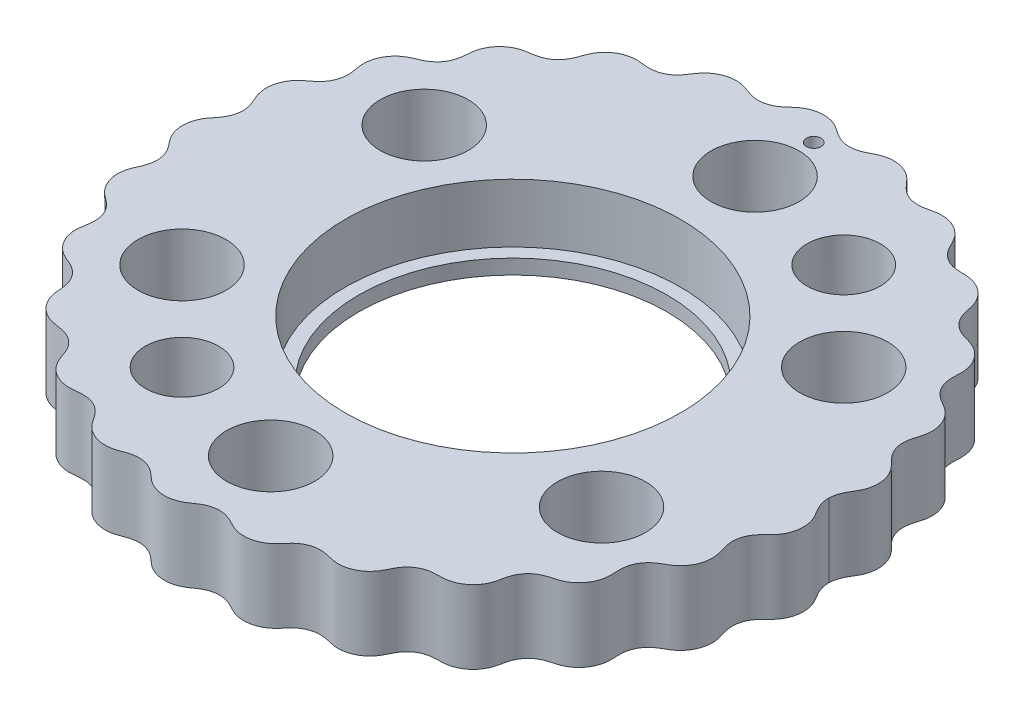
from build123d import *

# Parameters (mm, degrees)
BOSS_EXTRUDE1_DEPTH = 5
SKETCH2_R           = 11.425
CUT_EXTRUDE1_DEPTH  = 5
SKETCH3_R           = 3
CUT_EXTRUDE2_DEPTH  = 5
CIRPATTERN1_COUNT   = 6
SKETCH5_R           = 2.5
CUT_EXTRUDE3_DEPTH  = 5
CIRPATTERN2_COUNT   = 2
SKETCH6_R           = 0.5
CUT_EXTRUDE4_DEPTH  = 5
SKETCH7_R           = 12.374584978
SKETCH7_R_2         = 10.5
BOSS_EXTRUDE2_DEPTH = 1


with BuildPart() as part:
    # Sketch1 → Boss-Extrude1 (new body)
    with BuildSketch(Plane(origin=(0, 0, 0), x_dir=(1, 0, 0), z_dir=(0, 1, 0))):
        with BuildLine():
            add(Edge.make_bspline(
                [(21.5, 0), (21.5, -0.022795648), (21.501029798, -0.067704723), (21.505664016, -0.163287209), (21.517971578, -0.26706608), (21.536306326, -0.371602284), (21.560512677, -0.476256498), (21.597844303, -0.604628879), (21.648832285, -0.742870008), (21.715471931, -0.88939095), (21.798303927, -1.042889143), (21.880905824, -1.181287951), (21.965634084, -1.318335744), (22.047743353, -1.457058781), (22.141568148, -1.635443324), (22.286254031, -1.981582502), (22.368421524, -2.421033858), (22.335811077, -2.934910183), (22.174145209, -3.419701894), (21.99095847, -3.749480386), (21.771971642, -4.023287517), (21.538963332, -4.247536075), (21.287578906, -4.490419955), (21.052310467, -4.786004888), (20.86628673, -5.14590219), (20.761450474, -5.564770662), (20.755735036, -5.968942065), (20.822508646, -6.33892296), (20.926642695, -6.670776317), (21.020849566, -6.978393405), (21.078180272, -7.322549411), (21.07746081, -7.697824683), (21.003081253, -8.093784755), (20.843555833, -8.492539022), (20.623320583, -8.831594486), (20.362510139, -9.105298429), (20.080844855, -9.315588837), (19.798436738, -9.474596917), (19.494129238, -9.64843046), (19.193042299, -9.878112973), (18.922392637, -10.184987884), (18.716598269, -10.57271997), (18.614737076, -10.967683861), (18.592455277, -11.342616983), (18.611533827, -11.683028301), (18.624118313, -11.991107125), (18.595106734, -12.331071898), (18.502842362, -12.693216528), (18.332373701, -13.060611077), (18.07506318, -13.411620433), (17.774315371, -13.686679911), (17.45226868, -13.886415414), (17.125969418, -14.019230522), (16.812052534, -14.10255859), (16.473441864, -14.19622458), (16.124477284, -14.345719993), (15.780825809, -14.581977707), (15.478806711, -14.920833453), (15.28347244, -15.293586784), (15.174931043, -15.663684232), (15.111271631, -15.999784886), (15.043162779, -16.292876076), (14.927308659, -16.603267876), (14.748557662, -16.917576626), (14.495569598, -17.220812425), (14.163796574, -17.490305612), (13.806621751, -17.679399775), (13.443827203, -17.791931371), (13.093811397, -17.838332699), (12.768326214, -17.84035428), (12.416218343, -17.847687856), (12.040347656, -17.907509571), (11.649083059, -18.053250928), (11.273805116, -18.308626347), (10.993969347, -18.622244194), (10.798612314, -18.953719647), (10.654007457, -19.262720966), (10.514614641, -19.528768994), (10.324875693, -19.799088995), (10.073180539, -20.057986893), (9.752841289, -20.287160796), (9.363541622, -20.46556076), (8.890919825, -20.57649638), (8.423854169, -20.577347209), (8.001081062, -20.472684128), (7.57883967, -20.372597395), (7.198227195, -20.339565738), (6.783114608, -20.385259833), (6.356838556, -20.542207313), (6.00963401, -20.777770328), (5.73968902, -21.050783987), (5.523491298, -21.313556792), (5.322168119, -21.535472055), (5.07092742, -21.748791531), (4.763134857, -21.935439316), (4.29408165, -22.115901487), (3.783055418, -22.1727341), (3.297088475, -22.104238721), (2.866674117, -21.933132883), (2.579725015, -21.77656141), (2.265356433, -21.613984902), (1.904213196, -21.487930325), (1.489492014, -21.43166374), (1.038183469, -21.480080885), (0.644348302, -21.624091729), (0.316735371, -21.822019344), (0.042681085, -22.022602977), (-0.207399968, -22.186150065), (-0.597604776, -22.374600245), (-1.057287769, -22.479745044), (-1.563801935, -22.471181397), (-2.0548083, -22.332884975), (-2.397195938, -22.162174798), (-2.683863792, -21.952135463), (-2.922921233, -21.728064998), (-3.188279446, -21.492612679), (-3.508432994, -21.281556117), (-3.897493454, -21.125958051), (-4.347012431, -21.063310642), (-4.763563312, -21.107046937), (-5.128740485, -21.218475955), (-5.443245943, -21.34434571), (-5.725817036, -21.439628514), (-6.047650464, -21.503033396), (-6.405616351, -21.516023092), (-6.902823494, -21.445697437), (-7.377363339, -21.246774053), (-7.769557412, -20.949554121), (-8.063173053, -20.588651874), (-8.239077219, -20.311455053), (-8.438723108, -20.017116066), (-8.698282208, -19.733587722), (-9.038192038, -19.487722925), (-9.45901837, -19.317802372), (-9.873174211, -19.258864262), (-10.253551651, -19.277412057), (-10.588658346, -19.321104209), (-10.885442225, -19.342148983), (-11.212077228, -19.322458845), (-11.560942235, -19.24512832), (-12.024362415, -19.052244368), (-12.433895401, -18.74040472), (-12.739135206, -18.353567785), (-12.932764824, -17.929380009), (-13.03396784, -17.61633628), (-13.155335503, -17.281109595), (-13.338197746, -16.941939529), (-13.60842197, -16.620421988), (-13.975336461, -16.353398259), (-14.362209434, -16.195580127), (-14.73457759, -16.120567373), (-15.069235266, -16.079702705), (-15.361090299, -16.025484945), (-15.671490101, -15.924358306), (-15.988873392, -15.762127945), (-16.38887568, -15.459109626), (-16.707032953, -15.054306911), (-16.905517751, -14.602434605), (-16.986060099, -14.142225311), (-17.00606609, -13.812939099), (-17.051601747, -13.348551502), (-17.205253358, -12.865282323), (-17.522142778, -12.422071438), (-17.947236195, -12.110008614), (-18.289238992, -11.946244216), (-18.602329975, -11.823879909), (-18.870601873, -11.69813388), (-19.144821884, -11.522520555), (-19.410516215, -11.286178284), (-19.716878667, -10.89842961), (-19.923557011, -10.431222541), (-20.0056077, -9.944334415), (-19.970308009, -9.47363097), (-19.903591545, -9.135070859), (-19.83440386, -8.668455805), (-19.870044656, -8.161827089), (-20.070594664, -7.659669711), (-20.402230458, -7.259132681), (-20.692867795, -7.017192803), (-20.965060867, -6.821236211), (-21.192500704, -6.632420304), (-21.413104702, -6.393941278), (-21.610286017, -6.099056667), (-21.809358495, -5.646969614), (-21.892108847, -5.142649073), (-21.8490157, -4.650092571), (-21.695886456, -4.202493127), (-21.546389968, -3.890661396), (-21.364214881, -3.454313727), (-21.2752362, -2.953572409), (-21.347779944, -2.417613532), (-21.571739533, -1.94863668), (-21.793616501, -1.643608799), (-22.007962526, -1.38669879), (-22.180138863, -1.147218268), (-22.333166654, -0.861550026), (-22.449530911, -0.527309468), (-22.529817024, -0.03256193), (-22.480655767, 0.480654905), (-22.311295657, 0.946245125), (-22.002770959, 1.406141242), (-21.706912708, 1.735221765), (-21.458927528, 2.140901932), (-21.317293845, 2.626299801), (-21.299292376, 3.079506214), (-21.381563669, 3.48702089), (-21.521510343, 3.835956348), (-21.664791087, 4.137603074), (-21.770864519, 4.41201509), (-21.846804342, 4.726329942), (-21.875244476, 5.078219246), (-21.828721188, 5.577142974), (-21.652165295, 6.061707092), (-21.370775746, 6.470366782), (-20.955394907, 6.838363024), (-20.586320994, 7.084299028), (-20.245940934, 7.418047432), (-19.990156362, 7.854878416), (-19.862619111, 8.290106394), (-19.843143505, 8.704841324), (-19.893083468, 9.076451436), (-19.956586036, 9.403584096), (-19.989983786, 9.695061487), (-19.98440046, 10.017868008), (-19.92336198, 10.364355079), (-19.777759505, 10.76859641), (-19.507474752, 11.197000284), (-19.143216247, 11.547990856), (-18.706972183, 11.788081108), (-18.292122029, 11.941450822), (-17.941129322, 12.11582572), (-17.615038978, 12.359203902), (-17.34070718, 12.67707834), (-17.113066507, 13.113027475), (-16.996377802, 13.660569401), (-17.005440062, 14.33064165), (-16.736351844, 15.061621091), (-16.291275669, 15.574383195), (-15.7979407, 15.878565793), (-15.396019325, 16.015951733), (-15.107915534, 16.074466171), (-14.777158659, 16.114872858), (-14.407998329, 16.182770941), (-14.019697585, 16.329957912), (-13.645572173, 16.586426943), (-13.309830789, 16.965010476), (-13.098331613, 17.39191391), (-12.978574811, 17.818587814), (-12.756675288, 18.326990835), (-12.391345751, 18.802667249), (-11.899751276, 19.139902225), (-11.346793463, 19.309760982), (-10.921462874, 19.341850779), (-10.627753819, 19.325657195), (-10.352771787, 19.289869825), (-10.092339832, 19.268899376), (-9.790034832, 19.272905369), (-9.453775673, 19.325894331), (-9.082581512, 19.463746877), (-8.665300534, 19.748942197), (-8.356770982, 20.110327011), (-8.135426756, 20.493177528), (-7.793138218, 20.928144818), (-7.402598313, 21.232663484), (-6.929586979, 21.437663869), (-6.434154237, 21.513854894), (-6.080084769, 21.506172865), (-5.760958736, 21.448581022), (-5.479899184, 21.358530085), (-5.169132807, 21.233963947), (-4.810101908, 21.117475578), (-4.294692157, 21.050129493), (-3.762734746, 21.147605566), (-3.314509588, 21.387517302), (-2.956302797, 21.695711591), (-2.70600699, 21.934036961), (-2.327591546, 22.217460753), (-1.872484404, 22.410222198), (-1.367263375, 22.487008273), (-0.875779743, 22.437035066), (-0.534230894, 22.340275407), (-0.239225417, 22.203808062), (0.010720095, 22.045517624), (0.281222998, 21.847088875), (0.601784201, 21.645581136), (1.085181931, 21.454681383), (1.713456872, 21.414221877), (2.285360203, 21.597169023), (2.760125969, 21.888661976), (3.277579761, 22.099810423), (3.765454926, 22.171888366), (4.273850966, 22.119309227), (4.737062589, 21.947446426), (5.04408436, 21.76739805), (5.295754923, 21.560509399), (5.498217892, 21.343909703), (5.711462572, 21.083791212), (5.973369428, 20.809204665), (6.402018612, 20.501933684), (6.92169077, 20.338358431), (7.428580823, 20.342284694), (7.883936963, 20.442761402), (8.203134168, 20.525328514), (8.665489831, 20.590471533), (9.156357978, 20.540961927), (9.639490391, 20.363153423), (10.051125909, 20.076048833), (10.303448351, 19.823952951), (10.495425551, 19.559644236), (10.637039356, 19.298544842), (10.779422473, 18.992700986), (10.966305296, 18.661698904), (11.236504618, 18.342817726), (11.604285591, 18.076967478), (11.993693004, 17.919974798), (12.372607378, 17.851383689), (12.728707497, 17.839818708), (13.057515712, 17.840177666), (13.520445793, 17.786707274), (13.982364407, 17.61563913), (14.405246258, 17.322253996), (14.731660436, 16.940851875), (14.912872437, 16.63260165), (15.032330958, 16.327726763), (15.103825003, 16.038725539), (15.165888644, 15.706306209), (15.266247465, 15.338661943), (15.450893874, 14.963136334), (15.743113965, 14.615883469), (16.082257098, 14.369189107), (16.432078184, 14.210483663), (16.773548248, 14.111876661), (17.091314365, 14.030157301), (17.524866144, 13.862137886), (17.928362199, 13.580767219), (18.263889796, 13.19073197), (18.484127648, 12.739385361), (18.582166474, 12.39461443), (18.621040518, 12.068688435), (18.617487077, 11.770320786), (18.594985514, 11.432088901), (18.602267128, 11.050092249), (18.690025466, 10.640408926), (18.889186047, 10.232567725), (19.157805249, 9.911149431), (19.457555227, 9.672411827), (19.763404911, 9.493133531), (20.050142981, 9.334985578), (20.33811948, 9.127112021), (20.605883534, 8.854183997), (20.888811866, 8.42978777), (21.05316971, 7.950543986), (21.09486257, 7.480656398), (21.035775061, 7.051085558), (20.957227182, 6.762591153), (20.851116448, 6.439737209), (20.764464973, 6.066648157), (20.749805425, 5.647420165), (20.843970725, 5.203399706), (21.026126326, 4.826745307), (21.257881444, 4.522752818), (21.509545026, 4.274285066), (21.747053848, 4.049888267), (21.972856644, 3.776758231), (22.162877466, 3.446006394), (22.330082414, 2.964312058), (22.368812081, 2.458965522), (22.290922429, 1.993012818), (22.125008195, 1.591272309), (21.994846135, 1.363621445), (21.87535488, 1.173803592), (21.785454267, 1.019247931), (21.722934411, 0.901788111), (21.669930674, 0.788754145), (21.625769679, 0.680889323), (21.587572888, 0.570986416), (21.555769125, 0.458203223), (21.533902396, 0.359533486), (21.519555583, 0.274358498), (21.510433274, 0.19799304), (21.504891178, 0.134991461), (21.502254666, 0.092809793), (21.501200425, 0.067795492), (21.500828924, 0.055385745)],
                knots=[0.073583191, 0.073583191, 0.073583191, 0.073583191, 0.073583191, 0.074192321, 0.074801452, 0.075410582, 0.076019713, 0.076628843, 0.077237974, 0.078456235, 0.079374265, 0.080292296, 0.081210327, 0.082128358, 0.083046388, 0.083964419, 0.08580048, 0.090658674, 0.093093486, 0.095528298, 0.097369166, 0.099210034, 0.101050902, 0.10289177, 0.105333314, 0.107774857, 0.110206348, 0.112637839, 0.114469102, 0.116300365, 0.118131628, 0.119962891, 0.122386266, 0.124809641, 0.127250159, 0.129690678, 0.131536006, 0.133381334, 0.135226662, 0.13707199, 0.139519251, 0.141966513, 0.144472125, 0.146977736, 0.148732632, 0.150487529, 0.152242425, 0.153997321, 0.156478942, 0.158960563, 0.161406779, 0.163852994, 0.165702442, 0.167551891, 0.169401339, 0.171250788, 0.173704446, 0.176158103, 0.178823023, 0.181487943, 0.183199446, 0.18491095, 0.186622453, 0.188333956, 0.190722631, 0.193111307, 0.195563206, 0.198015106, 0.199868692, 0.201722278, 0.203575864, 0.20542945, 0.207889465, 0.210349481, 0.213008107, 0.215666734, 0.217374121, 0.219081508, 0.220788895, 0.222496282, 0.224879167, 0.227262052, 0.229719623, 0.232177194, 0.235892672, 0.237750411, 0.23960815, 0.242074483, 0.244540816, 0.247193118, 0.24984542, 0.251548717, 0.253252014, 0.254955311, 0.256658608, 0.259035704, 0.261412799, 0.266339253, 0.268201159, 0.270063065, 0.27192497, 0.273786876, 0.276259486, 0.278732096, 0.281378044, 0.284023991, 0.285723226, 0.287422461, 0.289121696, 0.290820931, 0.295563546, 0.298032413, 0.300501279, 0.302367364, 0.304233449, 0.306099534, 0.307965619, 0.310444465, 0.312923311, 0.315562871, 0.318202432, 0.319897635, 0.321592839, 0.323288042, 0.324983246, 0.327348769, 0.329714291, 0.334663268, 0.336533543, 0.338403818, 0.340274094, 0.342144369, 0.344629408, 0.347114448, 0.34974759, 0.352380732, 0.354071936, 0.35576314, 0.357454345, 0.359145549, 0.361505292, 0.363865035, 0.368825527, 0.370699924, 0.372574322, 0.374448719, 0.376323117, 0.378814306, 0.381305495, 0.383932188, 0.38655888, 0.388246119, 0.389933358, 0.391620596, 0.393307835, 0.395661805, 0.398015776, 0.402987959, 0.404866432, 0.406744906, 0.408623379, 0.410501853, 0.415496442, 0.418116653, 0.420736865, 0.422420174, 0.424103483, 0.425786791, 0.4274701, 0.429818306, 0.432166513, 0.436981538, 0.438946723, 0.440911909, 0.442877094, 0.444842279, 0.449687094, 0.452300794, 0.454914494, 0.45659391, 0.458273326, 0.459952742, 0.461632159, 0.463974611, 0.466317063, 0.471143276, 0.473112811, 0.475082345, 0.47705188, 0.479021414, 0.483877624, 0.486484782, 0.489091939, 0.490767439, 0.49244294, 0.494118441, 0.495793941, 0.498130775, 0.500467609, 0.50547458, 0.50736532, 0.50925606, 0.51303754, 0.515552875, 0.518068209, 0.520668795, 0.52326938, 0.524940989, 0.526612598, 0.528284207, 0.529955817, 0.532287078, 0.534618339, 0.5396368, 0.541531637, 0.543426474, 0.547216149, 0.549737402, 0.552258655, 0.554852639, 0.557446623, 0.559114383, 0.560782143, 0.562449903, 0.564117664, 0.566443365, 0.568769067, 0.572171945, 0.575574824, 0.577799992, 0.58002516, 0.582250328, 0.584475496, 0.587001023, 0.58952655, 0.593322186, 0.597117822, 0.602144604, 0.606799037, 0.608467842, 0.610136648, 0.611805454, 0.613474259, 0.616070046, 0.618665834, 0.621185478, 0.623705121, 0.627492561, 0.62938628, 0.63128, 0.636295332, 0.640960892, 0.642633558, 0.644306225, 0.645978891, 0.647651557, 0.648952748, 0.650253938, 0.652856318, 0.655370031, 0.657883743, 0.661662989, 0.663552612, 0.665442235, 0.670446062, 0.672784418, 0.675122775, 0.676799344, 0.678475912, 0.680152481, 0.68182905, 0.684437995, 0.68704694, 0.69190005, 0.693868398, 0.695836746, 0.697805095, 0.699773443, 0.704596609, 0.70694063, 0.70928465, 0.710965124, 0.712645599, 0.714326073, 0.716006547, 0.718622026, 0.721237504, 0.726079198, 0.730007196, 0.731971196, 0.733935195, 0.738747161, 0.741096938, 0.743446716, 0.745131093, 0.74681547, 0.748499847, 0.750184224, 0.752806206, 0.755428189, 0.760419456, 0.762296817, 0.764174178, 0.766051539, 0.7679289, 0.772897899, 0.775253443, 0.777608987, 0.779297304, 0.780985621, 0.782673937, 0.784362254, 0.786990709, 0.789619164, 0.79210868, 0.794598196, 0.796471483, 0.798344771, 0.800218058, 0.802091345, 0.807048641, 0.809409959, 0.811771278, 0.81346357, 0.815155862, 0.816848153, 0.818540445, 0.821175341, 0.823810237, 0.826293591, 0.828776945, 0.830646077, 0.832515208, 0.83438434, 0.836253471, 0.841199385, 0.843566485, 0.845933585, 0.847629885, 0.849326185, 0.851022485, 0.852718785, 0.85536009, 0.858001396, 0.860478545, 0.862955695, 0.864820639, 0.866685582, 0.868550526, 0.87041547, 0.8728828, 0.875350131, 0.880095902, 0.881796242, 0.883496582, 0.885196922, 0.886897262, 0.889544946, 0.892192629, 0.894663532, 0.897134434, 0.898995202, 0.90085597, 0.902716738, 0.904577505, 0.907039192, 0.909500878, 0.914258227, 0.915962636, 0.917667046, 0.919371456, 0.920223661, 0.921075866, 0.921739373, 0.922402881, 0.923066388, 0.923729896, 0.924393403, 0.925056911, 0.925388665, 0.925720419, 0.926052172, 0.926383926, 0.926383926, 0.926383926, 0.926383926, 0.926383926], degree=4))
            Line((21.500828924, 0.055385745), (21.5, 0))
        make_face()
    extrude(amount=BOSS_EXTRUDE1_DEPTH)

    # Sketch2 → Cut-Extrude1 (cut)
    with BuildSketch(Plane(origin=(0, 5, 0), x_dir=(1, 0, 0), z_dir=(0, 1, 0))):
        with Locations(Location((0, 0, 0), (0, 0, 270))):
            Circle(SKETCH2_R)
    extrude(amount=-CUT_EXTRUDE1_DEPTH, mode=Mode.SUBTRACT)

    # Sketch3 → Cut-Extrude2 (cut)
    with BuildSketch(Plane(origin=(0, 5, 0), x_dir=(1, 0, 0), z_dir=(0, 1, 0))):
        with Locations(Location((0, 16.5, 0), (0, 0, 270))):
            Circle(SKETCH3_R)
    cut_extrude2 = extrude(amount=-CUT_EXTRUDE2_DEPTH, mode=Mode.SUBTRACT)

    # CirPattern1: Cut-Extrude2 ×6 about axis
    cirpattern1_axis = Axis((0, 0, 0), (0, 1, 0))
    for i in range(1, CIRPATTERN1_COUNT):
        add(cut_extrude2.rotate(cirpattern1_axis, i * 360 / CIRPATTERN1_COUNT), mode=Mode.SUBTRACT)

    # Sketch5 → Cut-Extrude3 (cut)
    with BuildSketch(Plane(origin=(0, 5, 0), x_dir=(1, 0, 0), z_dir=(0, 1, 0))):
        with Locations(Location((8.25, 14.289419162, 0), (0, 0, 270))):
            Circle(SKETCH5_R)
    cut_extrude3 = extrude(amount=-CUT_EXTRUDE3_DEPTH, mode=Mode.SUBTRACT)

    # CirPattern2: Cut-Extrude3 ×2 about axis
    cirpattern2_axis = Axis((0, 0, 0), (0, 1, 0))
    for i in range(1, CIRPATTERN2_COUNT):
        add(cut_extrude3.rotate(cirpattern2_axis, i * 360 / CIRPATTERN2_COUNT), mode=Mode.SUBTRACT)

    # Sketch6 → Cut-Extrude4 (cut)
    with BuildSketch(Plane(origin=(0, 5, 0), x_dir=(1, 0, 0), z_dir=(0, 1, 0))):
        with Locations(Location((0, 20.5, 0), (0, 0, 270))):
            Circle(SKETCH6_R)
    extrude(amount=-CUT_EXTRUDE4_DEPTH, mode=Mode.SUBTRACT)

    # Sketch7 → Boss-Extrude2 (add)
    with BuildSketch(Plane.XZ):
        Circle(SKETCH7_R)
        with Locations(Location((0, 0, 0), (0, 0, 270))):
            Circle(SKETCH7_R_2, mode=Mode.SUBTRACT)
    extrude(amount=-BOSS_EXTRUDE2_DEPTH)


solid = part.part
